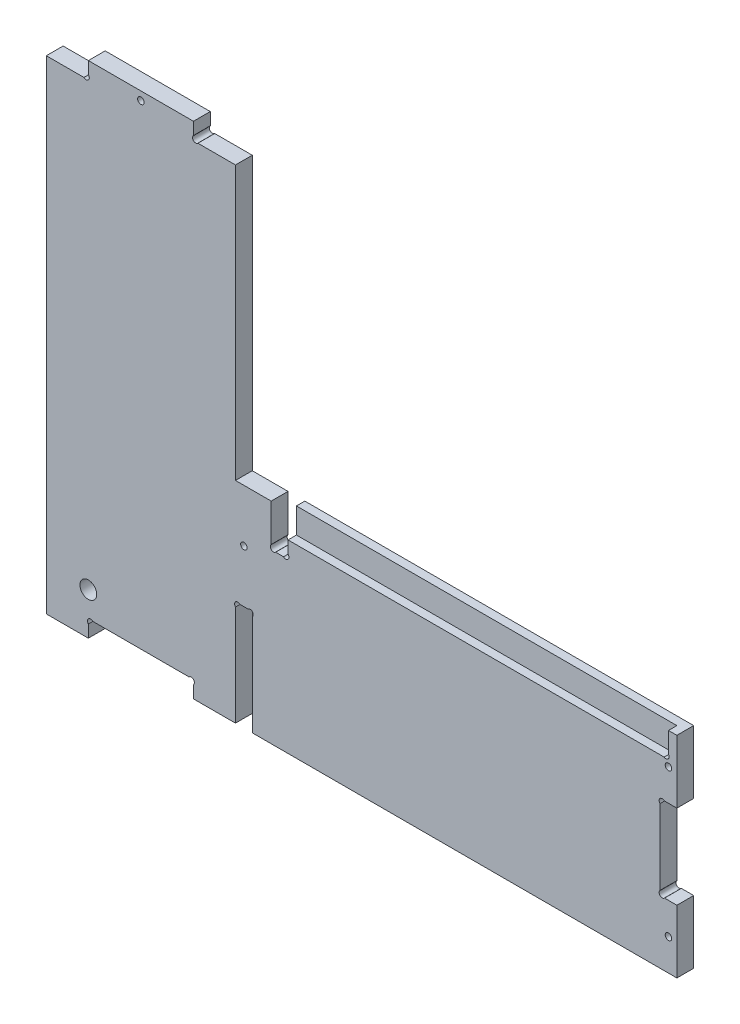
from build123d import *

# Parameters (mm, degrees)
ESQUISSE1_R             = 1.55
BOSS_EXTRU_1_DEPTH      = 8
ENL_V_MAT_EXTRU_1_DEPTH = 4
ESQUISSE3_R             = 4
ENL_V_MAT_EXTRU_2_DEPTH = 8


with BuildPart() as part:
    # Esquisse1 → Boss.-Extru.1 (new body)
    with BuildSketch(Plane.XY):
        with BuildLine():
            Line((-50.035172564, 24.058527132), (-50.035172564, -35.925114983))
            Line((-50.035172564, -35.925114983), (-30.035172564, -35.925114983))
            Line((-30.035172564, -35.925114983), (-30.035172564, -30.046435327))
            ThreePointArc((-30.035172564, -30.046435327), (-30.035172564, -27.925114983), (-27.913852221, -27.925114983))
            Line((-27.913852221, -27.925114983), (17.844379825, -27.925114983))
            ThreePointArc((17.844379825, -27.925114983), (19.965700169, -27.925114983), (19.965700169, -30.046435327))
            Line((19.965700169, -30.046435327), (19.965700169, -35.925114983))
            Line((19.965700169, -35.925114983), (39.964827436, -35.925114983))
            Line((39.964827436, -35.925114983), (39.964827436, 11.93808024))
            ThreePointArc((39.964827436, 11.93808024), (39.957922176, 14.050691679), (42.070406367, 14.074885017))
            Line((42.070406367, 14.074885017), (45.86099397, 14.074885017))
            ThreePointArc((45.86099397, 14.074885017), (47.974344085, 14.04981219), (47.964827436, 11.936334773))
            Line((47.964827436, 11.936334773), (47.964827436, -35.925114983))
            Line((47.964827436, -35.925114983), (249.964827436, -35.925114983))
            Line((249.964827436, -35.925114983), (249.964827436, -5.941472868))
            Line((249.964827436, -5.941472868), (244.087020512, -5.941472868))
            ThreePointArc((244.087020512, -5.941472868), (241.966136804, -5.941909324), (241.964827436, -3.821025976))
            Line((241.964827436, -3.821025976), (241.964827436, 31.937207148))
            ThreePointArc((241.964827436, 31.937207148), (241.964827616, 34.058527312), (244.086147779, 34.058527132))
            Line((244.086147779, 34.058527132), (249.964827436, 34.058527132))
            Line((249.964827436, 34.058527132), (249.964827436, 64.074885017))
            Line((249.964827436, 64.074885017), (64.964827436, 64.074885017))
            Line((64.964827436, 64.074885017), (64.964827436, 46.19620536))
            ThreePointArc((64.964827436, 46.19620536), (64.973452157, 44.066397786), (62.843644031, 44.074885017))
            Line((62.843644031, 44.074885017), (59.087020512, 44.074885017))
            ThreePointArc((59.087020512, 44.074885017), (56.965700528, 44.074011925), (56.964827436, 46.195331909))
            Line((56.964827436, 46.195331909), (56.964827436, 64.074885017))
            Line((56.964827436, 64.074885017), (39.964827436, 64.074885017))
            Line((39.964827436, 64.074885017), (39.964827436, 194.074885017))
            Line((39.964827436, 194.074885017), (22.086147779, 194.074885017))
            ThreePointArc((22.086147779, 194.074885017), (19.964827436, 194.074885017), (19.964827436, 196.19620536))
            Line((19.964827436, 196.19620536), (19.964827436, 202.074885017))
            Line((19.964827436, 202.074885017), (-30.035172564, 202.074885017))
            Line((-30.035172564, 202.074885017), (-30.035172564, 196.19620536))
            ThreePointArc((-30.035172564, 196.19620536), (-30.035172564, 194.074885017), (-32.156492908, 194.074885017))
            Line((-32.156492908, 194.074885017), (-50.035172564, 194.074885017))
            Line((-50.035172564, 194.074885017), (-50.035172564, 24.058527132))
        make_face()
        with Locations((43.965700169, 39.074885017)):
            Circle(ESQUISSE1_R, mode=Mode.SUBTRACT)
        with Locations((-5.034736198, 198.074885017)):
            Circle(ESQUISSE1_R, mode=Mode.SUBTRACT)
        with Locations((245.964827436, -20.925114983)):
            Circle(ESQUISSE1_R, mode=Mode.SUBTRACT)
        with Locations((245.964827481, 49.066706209)):
            Circle(ESQUISSE1_R, mode=Mode.SUBTRACT)
    extrude(amount=BOSS_EXTRU_1_DEPTH)

    # Esquisse2 → Enlèv. mat.-Extru.1 (cut)
    with BuildSketch(Plane.XY.offset(8)):
        with BuildLine():
            Line((60.964827436, 52.074885017), (243.898356115, 52.074885017))
            ThreePointArc((243.898356115, 52.074885017), (245.834400808, 52.256079256), (245.964827436, 54.19620536))
            Line((245.964827436, 54.19620536), (245.964827436, 64.074885017))
            Line((245.964827436, 64.074885017), (60.964827436, 64.074885017))
            Line((60.964827436, 64.074885017), (60.964827436, 52.074885017))
        make_face()
    extrude(amount=-ENL_V_MAT_EXTRU_1_DEPTH, mode=Mode.SUBTRACT)

    # Esquisse3 → Enlèv. mat.-Extru.2 (cut)
    with BuildSketch(Plane.XY.offset(8)):
        with Locations((-30.035172564, -15.925114983)):
            Circle(ESQUISSE3_R)
    extrude(amount=-ENL_V_MAT_EXTRU_2_DEPTH, mode=Mode.SUBTRACT)


solid = part.part
